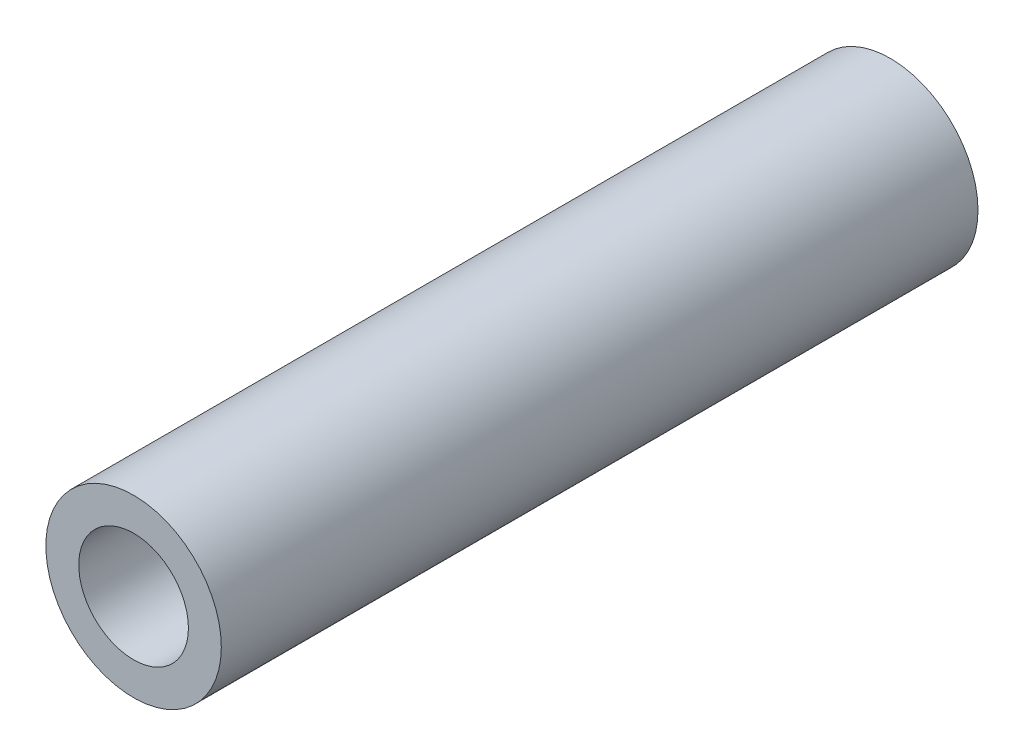
from build123d import *

# Parameters (mm, degrees)
SKETCH1_R      = 8
SKETCH1_R_2    = 5
EXTRUDE1_DEPTH = 69


with BuildPart() as part:
    # Sketch1 → Extrude1 (new body)
    with BuildSketch(Plane.XY):
        Circle(SKETCH1_R)
        Circle(SKETCH1_R_2, mode=Mode.SUBTRACT)
    extrude(amount=EXTRUDE1_DEPTH)


solid = part.part
